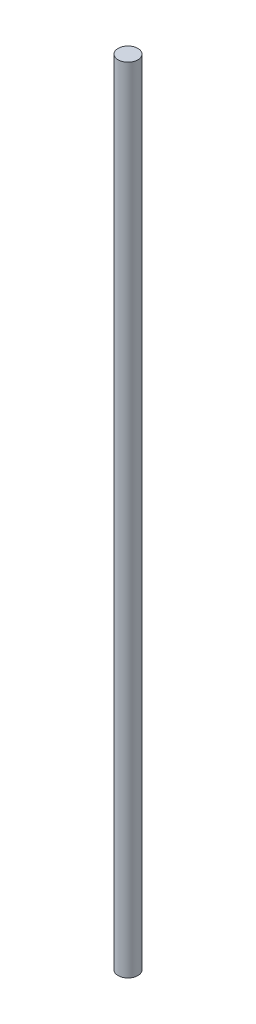
from build123d import *

# Parameters (mm, degrees)
SKETCH1_R           = 2.75
BOSS_EXTRUDE1_DEPTH = 110


with BuildPart() as part:
    # Sketch1 → Boss-Extrude1 (new, symmetric)
    with BuildSketch(Plane(origin=(0, 0, 0), x_dir=(1, 0, 0), z_dir=(0, 1, 0))):
        with Locations(Location((0, 0, 0), (0, 0, 270))):
            Circle(SKETCH1_R)
    extrude(amount=BOSS_EXTRUDE1_DEPTH, both=True)


solid = part.part
